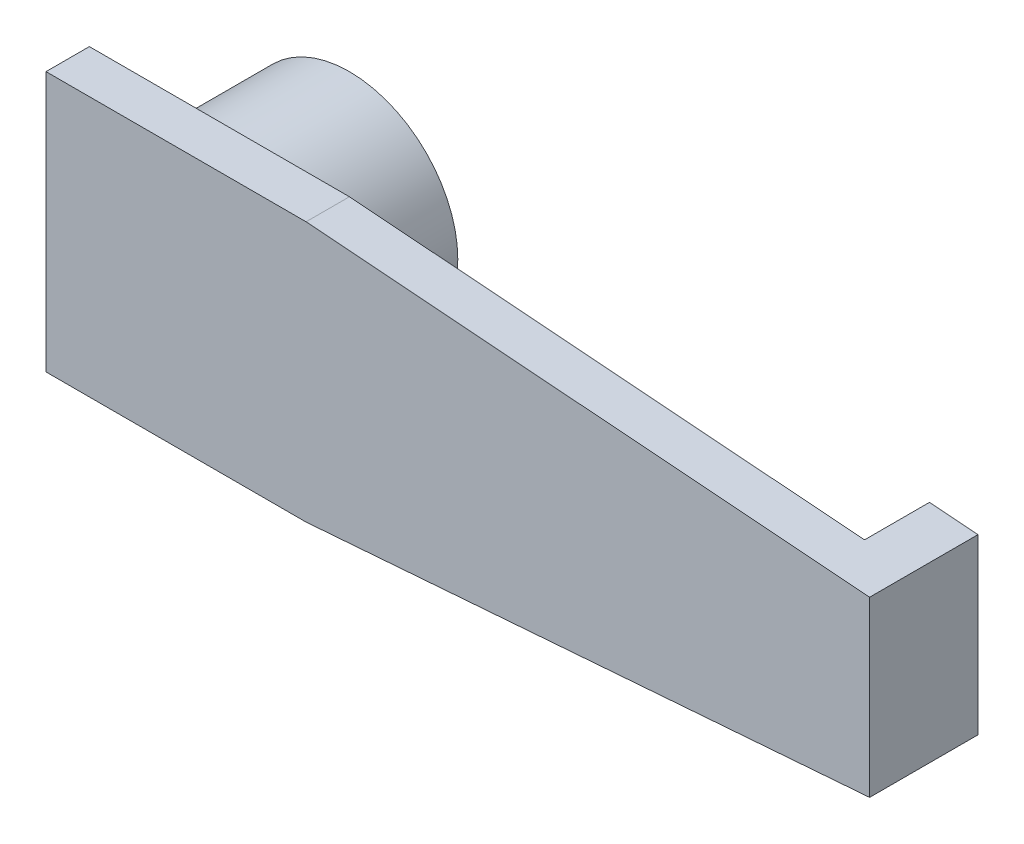
from build123d import *

# Parameters (mm, degrees)
SKETCH2_R           = 12.5
BOSS_EXTRUDE1_DEPTH = 15
SKETCH3_W           = 30
SKETCH3_H           = 30
BOSS_EXTRUDE2_DEPTH = 5
SKETCH6_W           = 10
SKETCH6_H           = 10
CUT_EXTRUDE1_DEPTH  = 15
BOSS_EXTRUDE3_DEPTH = 7.5


with BuildPart() as part:
    # Sketch2 → Boss-Extrude1 (new body)
    with BuildSketch(Plane.XY):
        Circle(SKETCH2_R)
    extrude(amount=BOSS_EXTRUDE1_DEPTH)

    # Sketch3 → Boss-Extrude2 (add)
    with BuildSketch(Plane.XY.offset(15)):
        Rectangle(SKETCH3_W, SKETCH3_H)
    extrude(amount=BOSS_EXTRUDE2_DEPTH)

    # Sketch5 → Loft1 section 0
    with BuildSketch(Plane(origin=(15, 0, 0), x_dir=(0, 0, -1), z_dir=(1, 0, 0))):
        with BuildLine():
            Line((-20, 15), (-15, 15))
            Line((-15, 15), (-15, -15))
            Line((-15, -15), (-20, -15))
            Line((-20, -15), (-20, 15))
        make_face()
    # Sketch4 → Loft1 section 1
    with BuildSketch(Plane(origin=(80, 0, 0), x_dir=(0, 0, -1), z_dir=(1, 0, 0))):
        with BuildLine():
            Line((-20, 10), (-15, 10))
            Line((-15, 10), (-15, -10))
            Line((-15, -10), (-20, -10))
            Line((-20, -10), (-20, 10))
        make_face()
    loft()

    # Sketch6 → Cut-Extrude1 (cut)
    with BuildSketch(Plane(origin=(0, 0, 0), x_dir=(-1, 0, 0), z_dir=(0, 0, -1))):
        Rectangle(SKETCH6_W, SKETCH6_H)
    extrude(amount=-CUT_EXTRUDE1_DEPTH, mode=Mode.SUBTRACT)

    # Sketch7 → Boss-Extrude3 (add)
    with BuildSketch(Plane(origin=(0, 0, 15), x_dir=(-1, 0, 0), z_dir=(0, 0, -1))):
        Polygon((-74.407472361, 10.430194434), (-74.407472361, -10.430194434), (-80, -10), (-80, 10), align=None)
    extrude(amount=BOSS_EXTRUDE3_DEPTH)


solid = part.part
